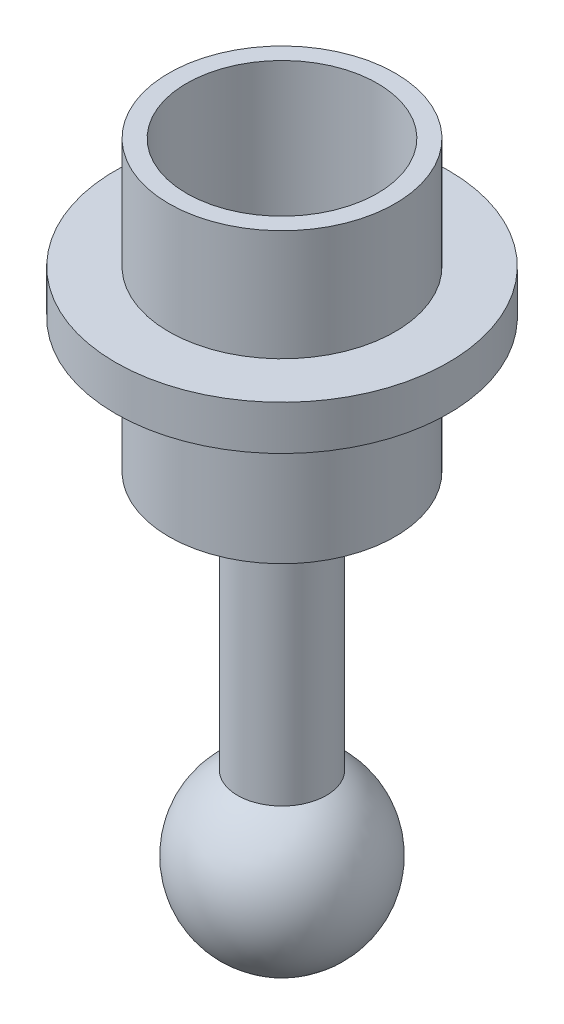
from build123d import *
from build123d.topology import SkipClean

# Parameters (mm, degrees)
SKETCH2_R           = 5.1000000000000005
BOSS_EXTRUDE1_DEPTH = 1
SKETCH3_R           = 5.1000000000000005
SKETCH3_R_2         = 4.3
BOSS_EXTRUDE2_DEPTH = 12
CUT_EXTRUDE2_DEPTH  = 1
SKETCH7_R           = 7.5
SKETCH7_R_2         = 5.1000000000000005
BOSS_EXTRUDE4_DEPTH = 2


with BuildPart() as part:
    # Sketch2 → Boss-Extrude1 (new body)
    with BuildSketch(Plane(origin=(0, 0, 0), x_dir=(1, 0, 0), z_dir=(0, 1, 0))):
        with Locations(Location((0, 0, 0), (0, 0, 270))):
            Circle(SKETCH2_R)
    extrude(amount=BOSS_EXTRUDE1_DEPTH)

    # Sketch3 → Boss-Extrude2 (add)
    with BuildSketch(Plane(origin=(0, 1, 0), x_dir=(1, 0, 0), z_dir=(0, 1, 0))):
        with Locations(Location((0, 0, 0), (0, 0, 270))):
            Circle(SKETCH3_R)
        with Locations(Location((0, 0, 0), (0, 0, 270))):
            Circle(SKETCH3_R_2, mode=Mode.SUBTRACT)
    extrude(amount=BOSS_EXTRUDE2_DEPTH)

    # Sketch6 → Cut-Extrude2 (cut)
    with BuildSketch(Plane(origin=(0, 1, 0), x_dir=(1, 0, 0), z_dir=(0, 1, 0))):
        with BuildLine():
            ThreePointArc((-1.767766952966369, 1.7677669529663689), (-2.1650635094610977, 1.2499999999999991), (-2.4148145657226716, 0.6470476127562977))
            Line((-2.4148145657226716, 0.6470476127562977), (-3.1875552267539264, 0.8541028488383131))
            ThreePointArc((-3.1875552267539264, 0.8541028488383131), (-2.857883832488649, 1.6499999999999986), (-2.333452377915607, 2.3334523779156067))
            Line((-2.333452377915607, 2.3334523779156067), (-1.767766952966369, 1.7677669529663689))
        make_face()
        with BuildLine():
            ThreePointArc((2.414814565722671, 0.6470476127563006), (2.1650635094610964, 1.2500000000000004), (1.7677669529663664, 1.7677669529663707))
            Line((1.7677669529663664, 1.7677669529663707), (2.3334523779156044, 2.3334523779156093))
            ThreePointArc((2.3334523779156044, 2.3334523779156093), (2.8578838324886475, 1.650000000000001), (3.1875552267539264, 0.8541028488383169))
            Line((3.1875552267539264, 0.8541028488383169), (2.414814565722671, 0.6470476127563006))
        make_face()
        with BuildLine():
            ThreePointArc((1.7677669529663684, -1.76776695296637), (2.1650635094610973, -1.2499999999999993), (2.414814565722671, -0.6470476127562991))
            Line((2.414814565722671, -0.6470476127562991), (3.1875552267539264, -0.8541028488383147))
            ThreePointArc((3.1875552267539264, -0.8541028488383147), (2.857883832488649, -1.6499999999999992), (2.3334523779156067, -2.333452377915608))
            Line((2.3334523779156067, -2.333452377915608), (1.7677669529663684, -1.76776695296637))
        make_face()
        with BuildLine():
            ThreePointArc((-0.6470476127563032, -2.4148145657226703), (7.1e-16, -2.5), (0.6470476127563044, -2.41481456572267))
            Line((0.6470476127563044, -2.41481456572267), (0.8541028488383218, -3.187555226753924))
            ThreePointArc((0.8541028488383218, -3.187555226753924), (9.3e-16, -3.3000000000000003), (-0.8541028488383201, -3.187555226753925))
            Line((-0.8541028488383201, -3.187555226753925), (-0.6470476127563032, -2.4148145657226703))
        make_face()
        with BuildLine():
            ThreePointArc((-2.414814565722671, -0.6470476127563016), (-2.1650635094610964, -1.250000000000001), (-1.7677669529663664, -1.7677669529663715))
            Line((-1.7677669529663664, -1.7677669529663715), (-2.3334523779156036, -2.33345237791561))
            ThreePointArc((-2.3334523779156036, -2.33345237791561), (-2.857883832488647, -1.6500000000000012), (-3.1875552267539256, -0.8541028488383182))
            Line((-3.1875552267539256, -0.8541028488383182), (-2.414814565722671, -0.6470476127563016))
        make_face()
        with BuildLine():
            ThreePointArc((0.6470476127563035, 2.4148145657226703), (-4e-16, 2.5), (-0.6470476127563042, 2.41481456572267))
            Line((-0.6470476127563042, 2.41481456572267), (-0.8541028488383214, 3.187555226753924))
            ThreePointArc((-0.8541028488383214, 3.187555226753924), (-5.3e-16, 3.3000000000000003), (0.8541028488383205, 3.187555226753925))
            Line((0.8541028488383205, 3.187555226753925), (0.6470476127563035, 2.4148145657226703))
        make_face()
    extrude(amount=-CUT_EXTRUDE2_DEPTH, mode=Mode.SUBTRACT)

    # Sketch7 → Boss-Extrude4 (add)
    with BuildSketch(Plane(origin=(0, 6, 0), x_dir=(1, 0, 0), z_dir=(0, 1, 0))):
        with Locations(Location((0, 0, 0), (0, 0, 270))):
            Circle(SKETCH7_R)
        with Locations(Location((0, 0, 0), (0, 0, 270))):
            Circle(SKETCH7_R_2, mode=Mode.SUBTRACT)
    extrude(amount=BOSS_EXTRUDE4_DEPTH)

    # Sketch8 → Revolve1 (revolve)
    with SkipClean():  # the faces are left unmerged after this step: merging them gives an invalid solid
        with BuildSketch(Plane(origin=(0, 0, 0), x_dir=(0, 0, -1), z_dir=(1, 0, 0)), mode=Mode.PRIVATE) as revolve1_sk:
            with BuildLine():
                ThreePointArc((2.0000000000000013, -11.651866191443357), (1.0373712321606319, -11.240497250076075), (-8.376e-14, -11.099999999999998))
                Line((0, -11.099999999999998), (0, -15))
                Line((0, -15), (0, -18.9))
                ThreePointArc((-7.2e-16, -18.900000000000002), (2.7577164466275366, -17.757716446627537), (3.9000000000000026, -15.000000000000002))
                ThreePointArc((3.9000000000000026, -15), (3.391902121229328, -13.075162344507984), (2.0000000000000013, -11.651866191443357))
            make_face()
            with BuildLine():
                Line((0, -15), (0, -11.099999999999998))
                ThreePointArc((-8.376e-14, -11.099999999999998), (-1.0373712321607116, -11.240497250076096), (-2.000000000000001, -11.651866191443355))
                ThreePointArc((-2.000000000000001, -11.651866191443355), (-3.759502749923914, -16.03737123216067), (-7.2e-16, -18.900000000000002))
                Line((0, -18.9), (0, -15))
            make_face()
            with BuildLine():
                Line((0, -11.099999999999998), (0, 0))
                Line((0, 0), (-2, 0))
                Line((-2, 0), (-2, -11.651866191443357))
                ThreePointArc((-2.000000000000001, -11.651866191443355), (-1.0373712321607116, -11.240497250076096), (-8.376e-14, -11.099999999999998))
            make_face()
        revolve(revolve1_sk.sketch.rotate(Axis((0, 0, 0), (0, -1, 0)), 180), axis=Axis((0, 0, 0), (0, -1, 0)))


solid = part.part
